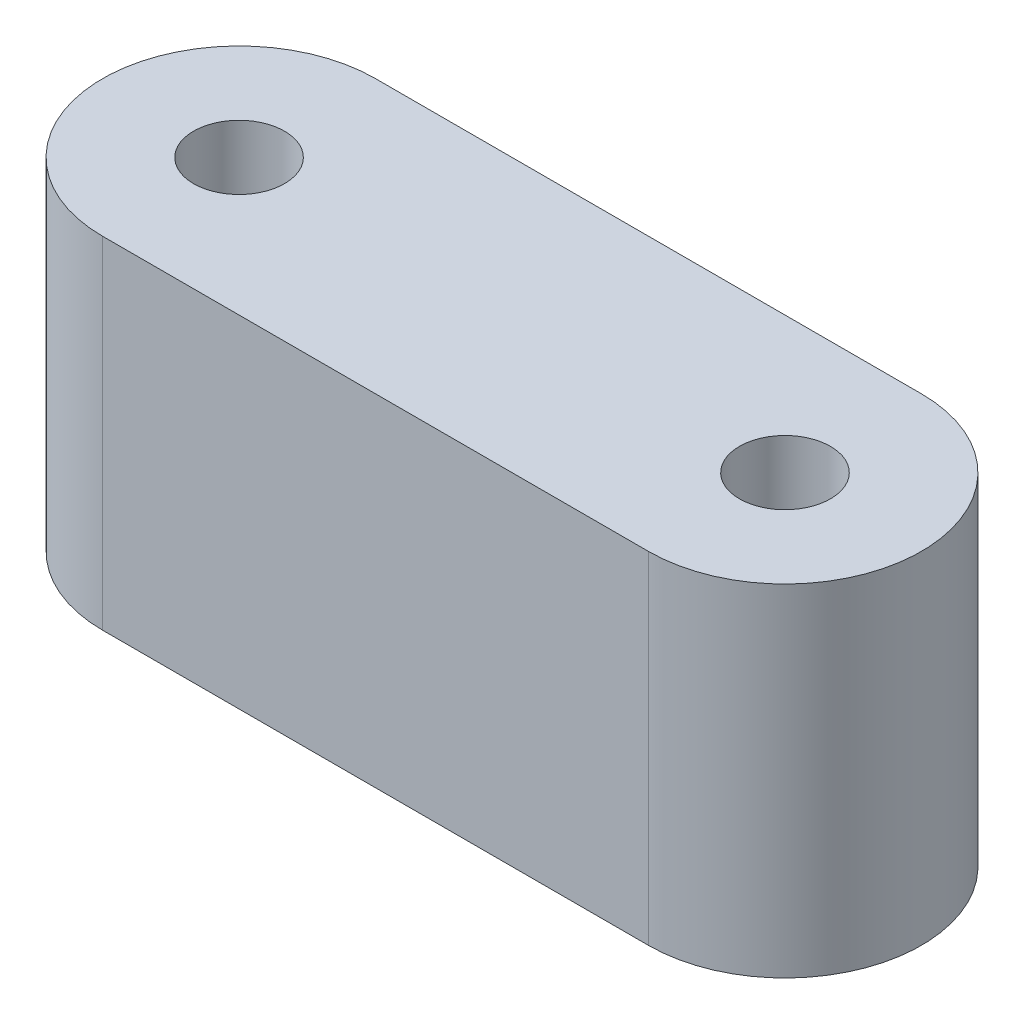
from build123d import *

# Parameters (mm, degrees)
SKETCH1_R           = 2
BOSS_EXTRUDE1_DEPTH = 15


with BuildPart() as part:
    # Sketch1 → Boss-Extrude1 (new body)
    with BuildSketch(Plane(origin=(0, 0, 0), x_dir=(1, 0, 0), z_dir=(0, 1, 0))):
        with BuildLine():
            Line((-12, 6), (12, 6))
            ThreePointArc((12, 6), (18, 0), (12, -6))
            Line((12, -6), (-12, -6))
            ThreePointArc((-12, -6), (-18, 0), (-12, 6))
        make_face()
        with Locations(Location((-12, 0, 0), (0, 0, 270))):
            Circle(SKETCH1_R, mode=Mode.SUBTRACT)
        with Locations(Location((12, 0, 0), (0, 0, 270))):
            Circle(SKETCH1_R, mode=Mode.SUBTRACT)
    extrude(amount=BOSS_EXTRUDE1_DEPTH)


solid = part.part
